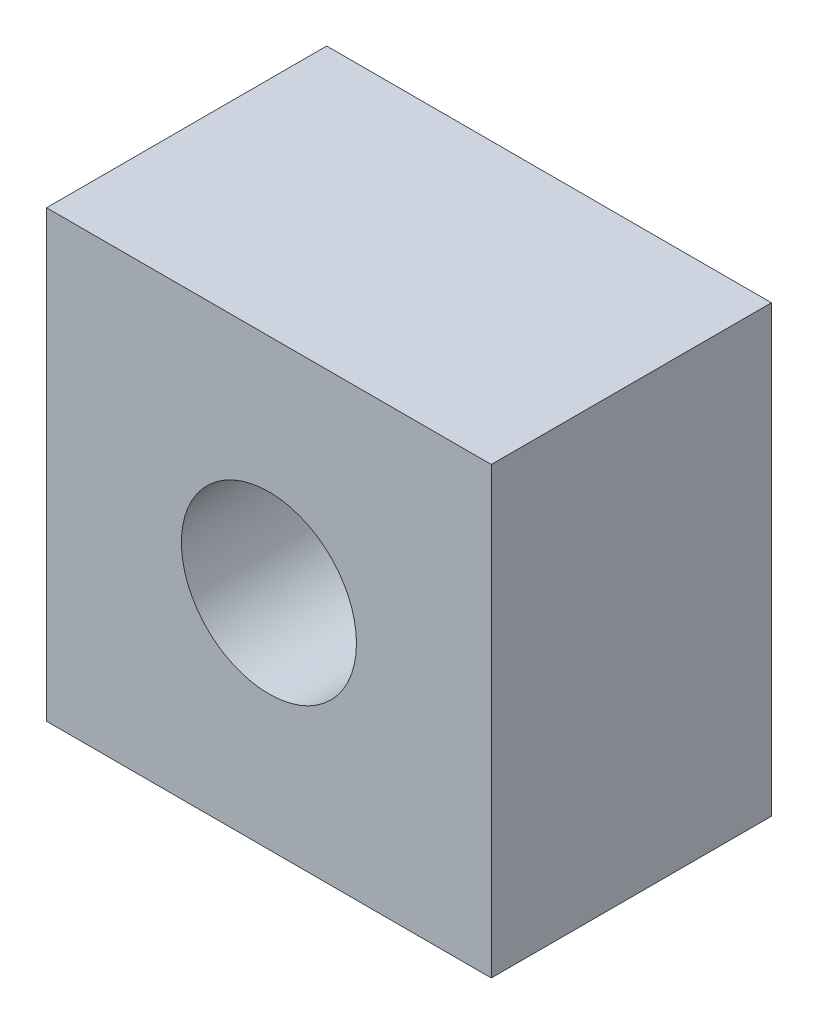
from build123d import *

# Parameters (mm, degrees)
SKETCH_1_W          = 2.54
SKETCH_1_H          = 2.54
EXTRUDE_1_DEPTH     = 1.6
SKETCH_2_R          = 0.5
CUT_EXTRUDE_1_DEPTH = 3.405368995


with BuildPart() as part:
    # ｽｹｯﾁ1 → ﾎﾞｽ - 押し出し1 (new body)
    with BuildSketch(Plane.XY):
        Rectangle(SKETCH_1_W, SKETCH_1_H)
    extrude(amount=EXTRUDE_1_DEPTH)

    # ｽｹｯﾁ2 → ｶｯﾄ - 押し出し1 (cut, through all)
    with BuildSketch(Plane.XY.offset(1.6)):
        Circle(SKETCH_2_R)
    extrude(amount=-CUT_EXTRUDE_1_DEPTH, mode=Mode.SUBTRACT)


solid = part.part
